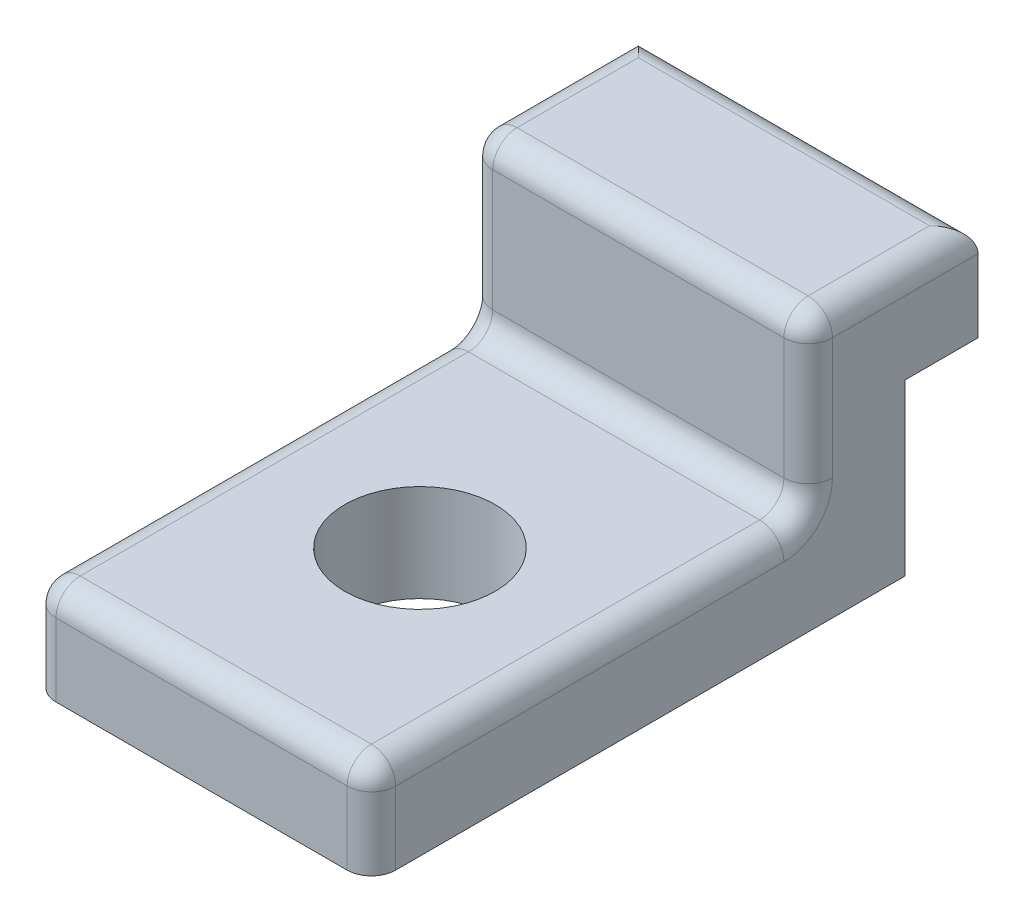
from build123d import *

# Parameters (mm, degrees)
ESBO_O1_W                = 7
ESBO_O1_H                = 11
RESSALTO_EXTRUS_O1_DEPTH = 2
ESBO_O2_W                = 7
ESBO_O2_H                = 2
RESSALTO_EXTRUS_O2_DEPTH = 3.5
ESBO_O3_W                = 7
ESBO_O3_H                = 2
RESSALTO_EXTRUS_O3_DEPTH = 1.5
ESBO_O4_R                = 1.55
CORTE_EXTRUS_O1_DEPTH    = 2
FILETE1_R                = 0.5


with BuildPart() as part:
    # Esboço1 → Ressalto-extrusão1 (new body)
    with BuildSketch(Plane(origin=(0, 0, 0), x_dir=(1, 0, 0), z_dir=(0, 1, 0))):
        Rectangle(ESBO_O1_W, ESBO_O1_H)
    extrude(amount=RESSALTO_EXTRUS_O1_DEPTH)

    # Esboço2 → Ressalto-extrusão2 (add)
    with BuildSketch(Plane(origin=(0, 2, 0), x_dir=(1, 0, 0), z_dir=(0, 1, 0))):
        with Locations((0, 4.5)):
            Rectangle(ESBO_O2_W, ESBO_O2_H)
    extrude(amount=RESSALTO_EXTRUS_O2_DEPTH)

    # Esboço3 → Ressalto-extrusão3 (add)
    with BuildSketch(Plane(origin=(0, 0, -5.5), x_dir=(-1, 0, 0), z_dir=(0, 0, -1))):
        with Locations((0, 4.5)):
            Rectangle(ESBO_O3_W, ESBO_O3_H)
    extrude(amount=RESSALTO_EXTRUS_O3_DEPTH)

    # Esboço4 → Corte-extrusão1 (cut)
    with BuildSketch(Plane(origin=(0, 2, 0), x_dir=(1, 0, 0), z_dir=(0, 1, 0))):
        with Locations(Location((0, -1, 0), (0, 0, 270))):
            Circle(ESBO_O4_R)
    extrude(amount=-CORTE_EXTRUS_O1_DEPTH, mode=Mode.SUBTRACT)

    # Filete1
    filete1_edges = [part.edges().sort_by_distance(p)[0] for p in [
        (-3.5, 2, 1),
        (0, 2, -3.5),
        (-3.5, 3.75, -3.5),
        (0, 2, 5.5),
        (3.5, 3.75, -3.5),
        (-3.5, 5.5, -5.25),
        (0, 5.5, -3.5),
        (3.5, 5.5, -5.25),
        (0, 5.5, -7),
        (3.5, 2, 1),
        (3.5, 1, 5.5),
        (-3.5, 1, 5.5),
    ]]
    fillet(filete1_edges, radius=FILETE1_R)


solid = part.part
